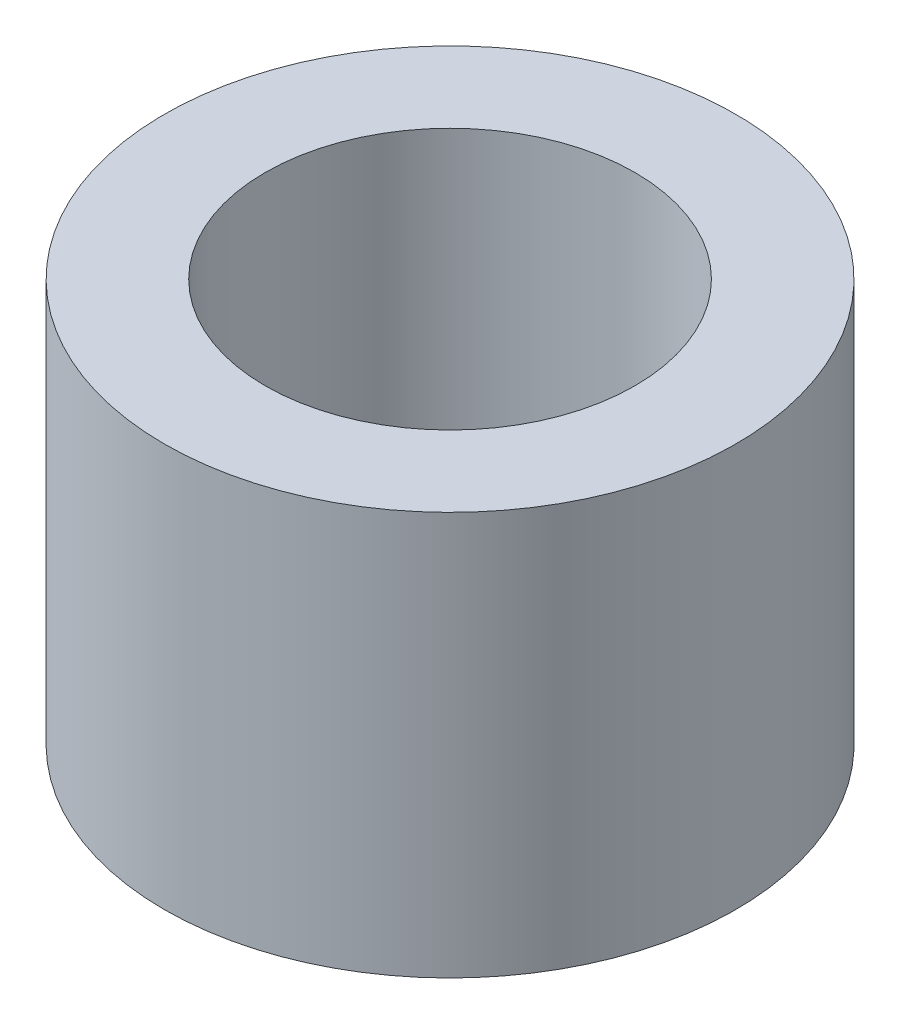
from build123d import *

# Parameters (mm, degrees)
SKETCH1_R           = 4.25
SKETCH1_R_2         = 2.75
BOSS_EXTRUDE1_DEPTH = 6


with BuildPart() as part:
    # Sketch1 → Boss-Extrude1 (new body)
    with BuildSketch(Plane(origin=(0, 0, 0), x_dir=(1, 0, 0), z_dir=(0, 1, 0))):
        Circle(SKETCH1_R)
        Circle(SKETCH1_R_2, mode=Mode.SUBTRACT)
    extrude(amount=BOSS_EXTRUDE1_DEPTH)


solid = part.part
